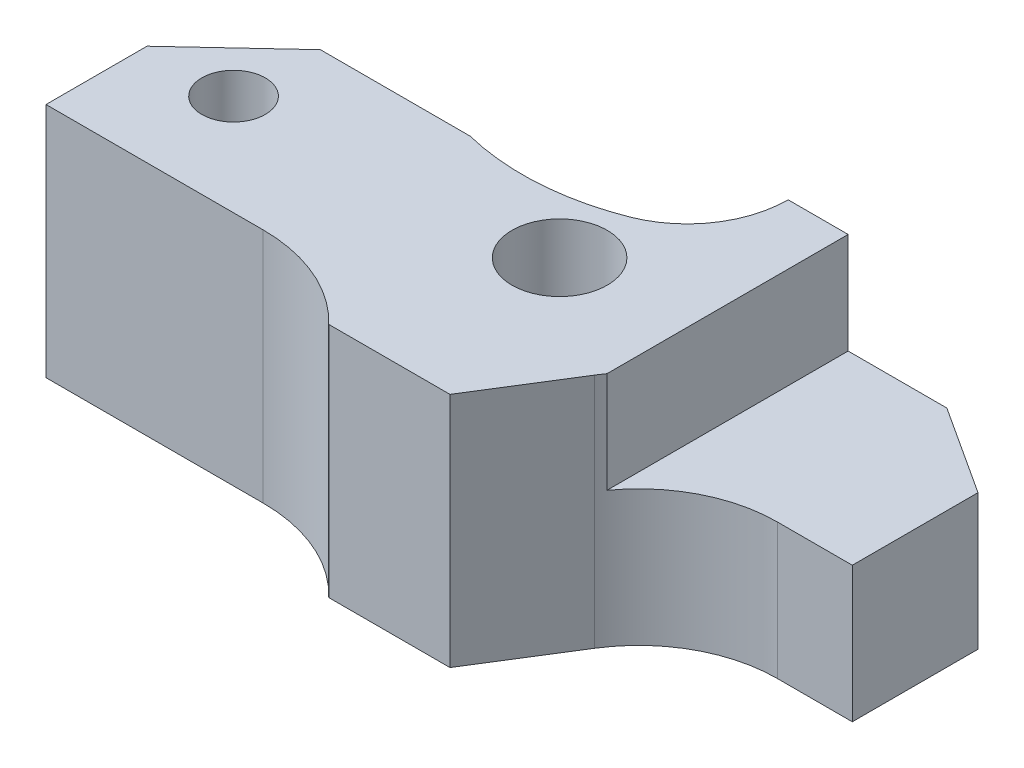
from build123d import *

# Parameters (mm, degrees)
SKETCH1_R           = 16.5
BOSS_EXTRUDE1_DEPTH = 82
SKETCH2_R           = 11
CUT_EXTRUDE1_DEPTH  = 276.268959383
SKETCH5_W           = 65
SKETCH5_H           = 35
CUT_EXTRUDE2_DEPTH  = 282.890049487
CUT_EXTRUDE3_DEPTH  = 40


with BuildPart() as part:
    # Sketch1 → Boss-Extrude1 (new body)
    with BuildSketch(Plane(origin=(0, 0, 0), x_dir=(1, 0, 0), z_dir=(0, 1, 0))):
        with BuildLine():
            Line((212.202700724, 100), (157.202700724, 100))
            ThreePointArc((157.202700724, 100), (151.120923095, 80.283600356), (134.9891913, 67.419244043))
            ThreePointArc((134.9891913, 67.419244043), (109.260251558, 61.670356138), (83, 64))
            Line((83, 64), (31.098692591, 64))
            Line((31.098692591, 64), (0, 35))
            Line((0, 35), (0, 0))
            Line((0, 0), (75.238209296, 0))
            ThreePointArc((75.238209296, 0), (96.859957606, -4.428268766), (115, -17))
            Line((115, -17), (157, -17))
            Line((157, -17), (176.293691384, 13.876360515))
            ThreePointArc((176.293691384, 13.876360515), (193.729138228, 30.421981775), (217, 36.440235832))
            Line((217, 36.440235832), (243, 36.440235832))
            Line((243, 36.440235832), (243, 80))
            Line((243, 80), (212.202700724, 100))
        make_face()
        with Locations(Location((135, 43, 0), (0, 0, 270))):
            Circle(SKETCH1_R, mode=Mode.SUBTRACT)
    extrude(amount=BOSS_EXTRUDE1_DEPTH)

    # Sketch2 → Cut-Extrude1 (cut, through all)
    with BuildSketch(Plane(origin=(0, 82, 0), x_dir=(1, 0, 0), z_dir=(0, 1, 0))):
        with Locations(Location((30, 35, 0), (0, 0, 270))):
            Circle(SKETCH2_R)
    extrude(amount=-CUT_EXTRUDE1_DEPTH, mode=Mode.SUBTRACT)

    # Sketch5 → Cut-Extrude2 (cut, through all)
    with BuildSketch(Plane(origin=(0, 0, -100), x_dir=(-1, 0, 0), z_dir=(0, 0, -1))):
        with Locations((-210.5, 64.5)):
            Rectangle(SKETCH5_W, SKETCH5_H)
    extrude(amount=-CUT_EXTRUDE2_DEPTH, mode=Mode.SUBTRACT)

    # Sketch6 → Cut-Extrude3 (cut)
    with BuildSketch(Plane(origin=(0, 15, 0), x_dir=(-1, 0, 0), z_dir=(0, -1, 0))):
        with BuildLine():
            Line((0, 12), (0, 35))
            Line((0, 35), (-31.098692591, 64))
            Line((-31.098692591, 64), (-74.689647512, 64))
            ThreePointArc((-74.689647512, 64), (-49.282519579, 20.85341744), (0, 12))
        make_face()
    extrude(amount=-CUT_EXTRUDE3_DEPTH, mode=Mode.SUBTRACT)


solid = part.part
